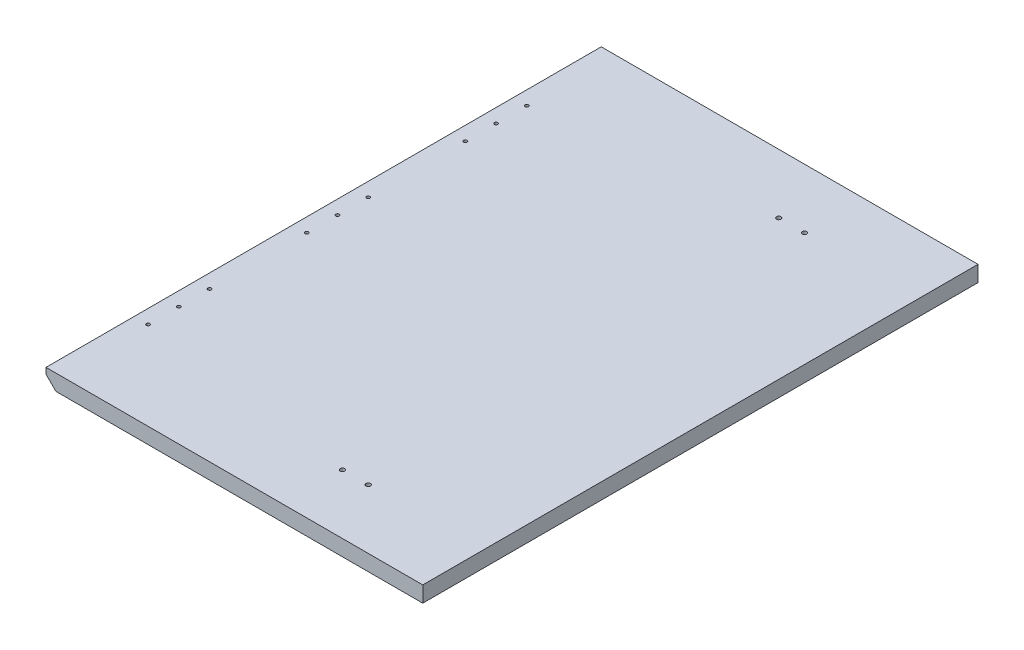
from build123d import *

# Parameters (mm, degrees)
SKETCH1_W                                 = 380
SKETCH1_H                                 = 560
BOSS_EXTRUDE1_DEPTH                       = 16
SKETCH2_W                                 = 30
SKETCH2_H                                 = 85
CUT_EXTRUDE1_DEPTH                        = 10
CHAMFER2_SIZE                             = 10
F_8_36_TAPPED_HOLE1_AT_2_COUNT            = 2
F_8_36_TAPPED_HOLE1_AT_2_PITCH            = 31
F_8_36_TAPPED_HOLE1_AT_3_COUNT            = 2
F_8_36_TAPPED_HOLE1_AT_3_PITCH            = 62
LPATTERN1_COUNT                           = 3
LPATTERN1_PITCH                           = 160
CSK_FOR_8_FLAT_HEAD_MACHINE_SCREW_2_COUNT = 2
CSK_FOR_8_FLAT_HEAD_MACHINE_SCREW_2_PITCH = 26


with BuildPart() as part:
    # Sketch1 → Boss-Extrude1 (new body)
    with BuildSketch(Plane(origin=(0, 0, 0), x_dir=(1, 0, 0), z_dir=(0, 1, 0))):
        Rectangle(SKETCH1_W, SKETCH1_H)
    extrude(amount=BOSS_EXTRUDE1_DEPTH)

    # Sketch2 → Cut-Extrude1 (cut)
    with BuildSketch(Plane.XZ):
        with Locations((-175, 160)):
            Rectangle(SKETCH2_W, SKETCH2_H)
        with Locations((-175, 0)):
            Rectangle(SKETCH2_W, SKETCH2_H)
        with Locations((-175, -160)):
            Rectangle(SKETCH2_W, SKETCH2_H)
    extrude(amount=-CUT_EXTRUDE1_DEPTH, mode=Mode.SUBTRACT)

    # Chamfer2
    chamfer2_edges = [part.edges().sort_by_distance(p)[0] for p in [
        (-190, 0, 241.25),
        (-190, 0, 80),
        (-190, 0, -80),
        (-190, 0, -241.25),
    ]]
    chamfer(chamfer2_edges, length=CHAMFER2_SIZE)

    # Sketch5 → #8-36 Tapped Hole1 (revolve, cut)
    with BuildSketch(Plane(origin=(-176, 10, 191), x_dir=(0, 0, -1), z_dir=(1, 0, 0))):
        Polygon((0, 0), (0, 26.037806461), (1.7272, 25), (1.7272, 0), align=None)
    f_8_36_tapped_hole1 = revolve(axis=Axis((-176, 3.65, 191), (0, 1, 0)), mode=Mode.SUBTRACT)

    # #8-36 Tapped Hole1 at 2: #8-36 Tapped Hole1 ×2
    with Locations(*[(0, 0, -i * F_8_36_TAPPED_HOLE1_AT_2_PITCH) for i in range(1, F_8_36_TAPPED_HOLE1_AT_2_COUNT)]):
        add(f_8_36_tapped_hole1, mode=Mode.SUBTRACT)

    # #8-36 Tapped Hole1 at 3: #8-36 Tapped Hole1 ×2
    with Locations(*[(0, 0, -i * F_8_36_TAPPED_HOLE1_AT_3_PITCH) for i in range(1, F_8_36_TAPPED_HOLE1_AT_3_COUNT)]):
        add(f_8_36_tapped_hole1, mode=Mode.SUBTRACT)

    # LPattern1: #8-36 Tapped Hole1 ×3
    with Locations(*[(0, 0, -i * LPATTERN1_PITCH) for i in range(1, LPATTERN1_COUNT)]):
        add(f_8_36_tapped_hole1, mode=Mode.SUBTRACT)

    # LPattern1 copy 1 sketch → LPattern1 copy 1 (revolve, cut)
    with BuildSketch(Plane(origin=(-176, 10, 0), x_dir=(0, 0, -1), z_dir=(1, 0, 0))):
        Polygon((0, 0), (0, 26.037806461), (1.7272, 25), (1.7272, 0), align=None)
    revolve(axis=Axis((-176, 3.65, 0), (0, 1, 0)), mode=Mode.SUBTRACT)

    # LPattern1 copy 2 sketch → LPattern1 copy 2 (revolve, cut)
    with BuildSketch(Plane(origin=(-176, 10, -160), x_dir=(0, 0, -1), z_dir=(1, 0, 0))):
        Polygon((0, 0), (0, 26.037806461), (1.7272, 25), (1.7272, 0), align=None)
    revolve(axis=Axis((-176, 3.65, -160), (0, 1, 0)), mode=Mode.SUBTRACT)

    # LPattern1 copy 3 sketch → LPattern1 copy 3 (revolve, cut)
    with BuildSketch(Plane(origin=(-176, 10, -31), x_dir=(0, 0, -1), z_dir=(1, 0, 0))):
        Polygon((0, 0), (0, 26.037806461), (1.7272, 25), (1.7272, 0), align=None)
    revolve(axis=Axis((-176, 3.65, -31), (0, 1, 0)), mode=Mode.SUBTRACT)

    # LPattern1 copy 4 sketch → LPattern1 copy 4 (revolve, cut)
    with BuildSketch(Plane(origin=(-176, 10, -191), x_dir=(0, 0, -1), z_dir=(1, 0, 0))):
        Polygon((0, 0), (0, 26.037806461), (1.7272, 25), (1.7272, 0), align=None)
    revolve(axis=Axis((-176, 3.65, -191), (0, 1, 0)), mode=Mode.SUBTRACT)

    # Sketch8 → CSK for #8 Flat Head Machine Screw (100)1 (revolve, cut)
    with BuildSketch(Plane(origin=(75, 0, 220), x_dir=(0, 0, -1), z_dir=(1, 0, 0))):
        Polygon((0, 0), (0, 26.350674586), (2.2479, 25), (2.2479, 1.651767624), (4.2164, 0), align=None)
    csk_for_8_flat_head_machine_screw_100 = revolve(axis=Axis((75, -6.35, 220), (0, 1, 0)), mode=Mode.SUBTRACT)

    # CSK for _8 Flat Head Machine Screw _ 2: CSK for #8 Flat Head Machine Screw (100)1 ×2
    with Locations(*[(-i * CSK_FOR_8_FLAT_HEAD_MACHINE_SCREW_2_PITCH, 0, 0) for i in range(1, CSK_FOR_8_FLAT_HEAD_MACHINE_SCREW_2_COUNT)]):
        add(csk_for_8_flat_head_machine_screw_100, mode=Mode.SUBTRACT)

    # Mirror1: CSK for #8 Flat Head Machine Screw (100)1 across plane
    add(csk_for_8_flat_head_machine_screw_100.mirror(Plane.XY), mode=Mode.SUBTRACT)

    # Mirror1 copy 1 sketch → Mirror1 copy 1 (revolve, cut)
    with BuildSketch(Plane(origin=(49, 0, -220), x_dir=(0, 0, 1), z_dir=(1, 0, 0))):
        Polygon((0, 0), (0, -26.350674586), (2.2479, -25), (2.2479, -1.651767624), (4.2164, 0), align=None)
    revolve(axis=Axis((49, -6.35, -220), (0, -1, 0)), mode=Mode.SUBTRACT)


solid = part.part
